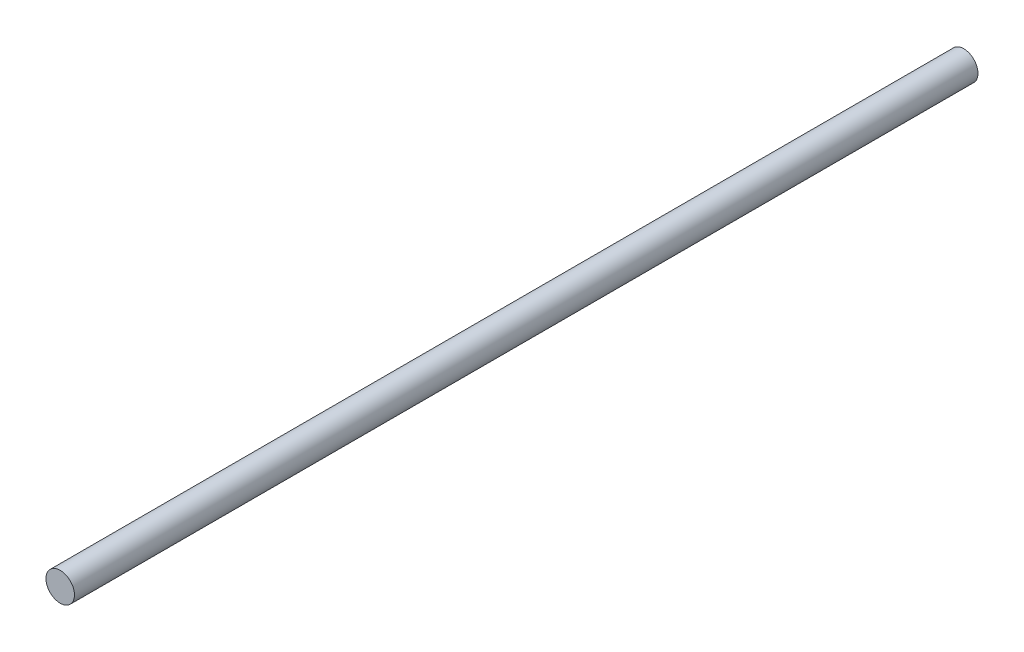
from build123d import *

# Parameters (mm, degrees)
SKETCH1_R           = 2.5
BOSS_EXTRUDE1_DEPTH = 158.5


with BuildPart() as part:
    # Sketch1 → Boss-Extrude1 (new body)
    with BuildSketch(Plane.XY):
        Circle(SKETCH1_R)
    extrude(amount=BOSS_EXTRUDE1_DEPTH)


solid = part.part
